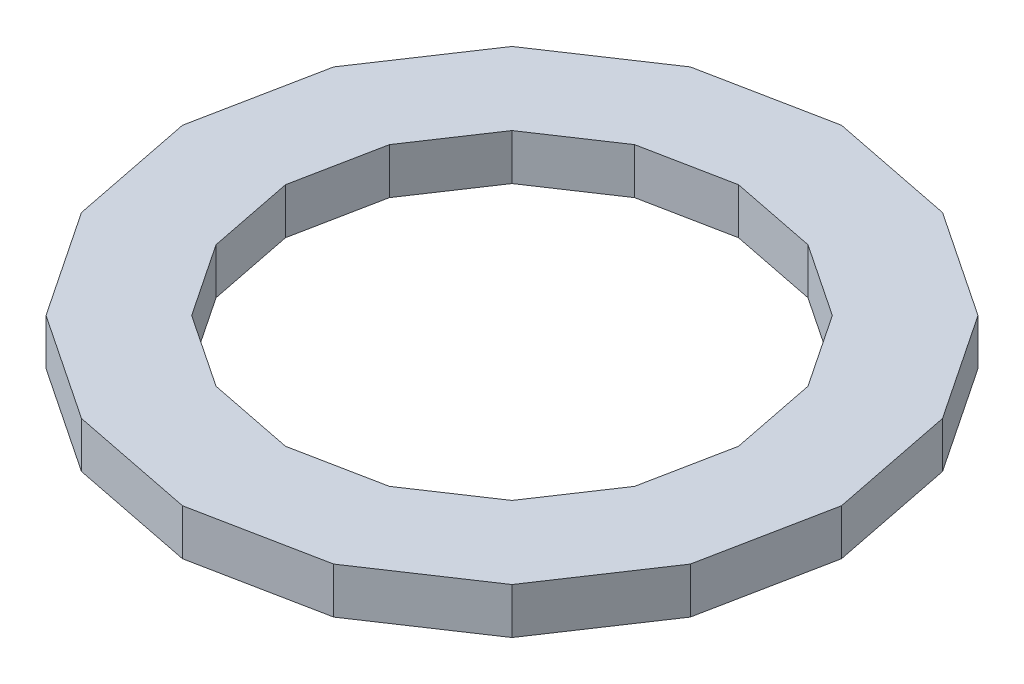
from build123d import *

# Parameters (mm, degrees)
BOSS_EXTRUDE1_DEPTH = 19.05


with BuildPart() as part:
    # Sketch1 → Boss-Extrude1 (new body)
    with BuildSketch(Plane(origin=(0, 0, 0), x_dir=(1, 0, 0), z_dir=(0, 1, 0))):
        Polygon((136.705909983, 0), (126.299792206, 52.315086857), (96.665675977, 96.665675977), (52.315086857, 126.299792206), (0, 136.705909983), (-52.315086857, 126.299792206), (-96.665675977, 96.665675977), (-126.299792206, 52.315086857), (-136.705909983, 0), (-126.299792206, -52.315086857), (-96.665675977, -96.665675977), (-52.315086857, -126.299792206), (0, -136.705909983), (52.315086857, -126.299792206), (96.665675977, -96.665675977), (126.299792206, -52.315086857), align=None)
        Polygon((93.974844542, 0), (86.821435443, 35.962616065), (66.450249837, 66.450249837), (35.962616065, 86.821435443), (0, 93.974844542), (-35.962616065, 86.821435443), (-66.450249837, 66.450249837), (-86.821435443, 35.962616065), (-93.974844542, 0), (-86.821435443, -35.962616065), (-66.450249837, -66.450249837), (-35.962616065, -86.821435443), (0, -93.974844542), (35.962616065, -86.821435443), (66.450249837, -66.450249837), (86.821435443, -35.962616065), align=None, mode=Mode.SUBTRACT)
    extrude(amount=BOSS_EXTRUDE1_DEPTH)


solid = part.part
